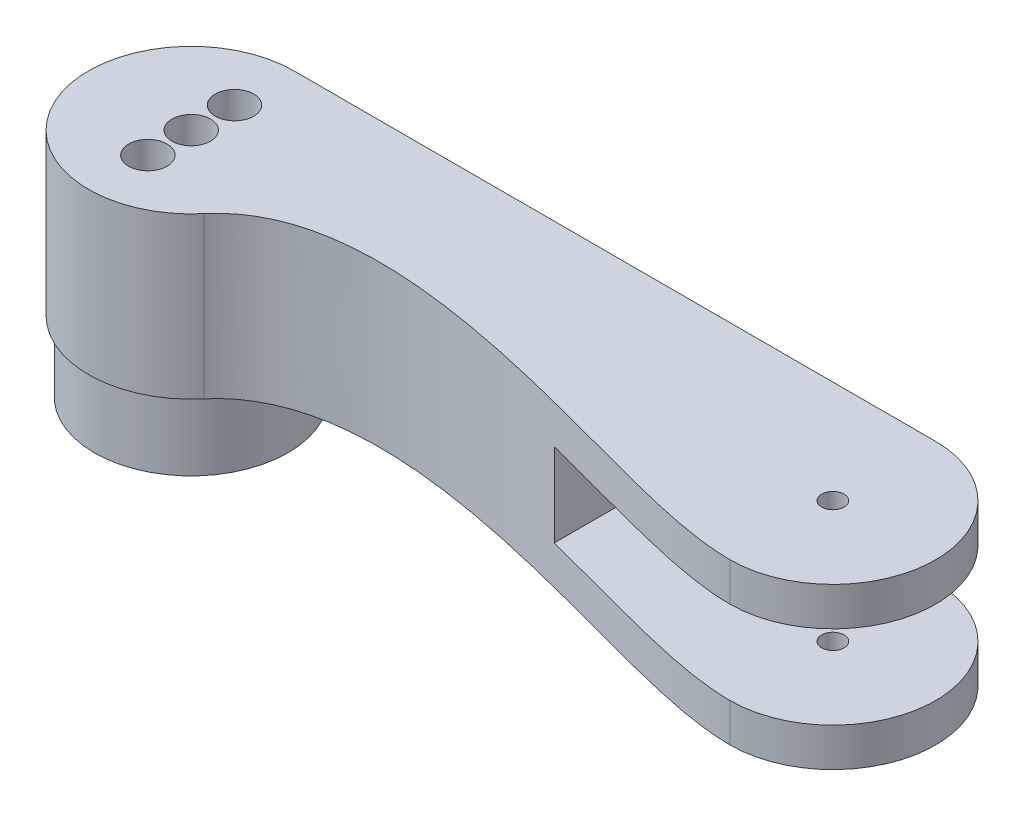
from build123d import *

# Parameters (mm, degrees)
BOSS_EXTRUDE1_DEPTH            = 6
SKETCH3_R                      = 1.75
CUT_EXTRUDE2_DEPTH             = 69.176242196
BOSS_EXTRUDE2_DEPTH            = 13
BOSS_EXTRUDE3_DEPTH            = 6
CUT_EXTRUDE3_REACH             = 74.367
SKETCH6_R                      = 1.75
CUT_EXTRUDE4_REACH             = 74.367
SKETCH8_R                      = 15.1
BOSS_EXTRUDE4_DEPTH            = 11
SKETCH9_R                      = 1.75
CUT_EXTRUDE5_DEPTH             = 10
CUT_EXTRUDE6_REACH             = 78.864
SKETCH11_R                     = 3
CUT_EXTRUDE6_DIRECTION_2_DEPTH = 77.863515556
CUT_EXTRUDE7_REACH             = 74.719
SKETCH12_R                     = 3


with BuildPart() as part:
    # Sketch1 → Boss-Extrude1 (new body)
    with BuildSketch(Plane(origin=(0, 0, 0), x_dir=(1, 0, 0), z_dir=(0, 1, 0))):
        with BuildLine():
            Line((-50, 16), (50, 16))
            ThreePointArc((50, 16), (66, 0), (50, -16))
            Line((50, -16), (-50, -16))
            ThreePointArc((-50, -16), (-66, 0), (-50, 16))
        make_face()
    extrude(amount=BOSS_EXTRUDE1_DEPTH)

    # Sketch3 → Cut-Extrude2 (cut, through all)
    with BuildSketch(Plane.XZ):
        with Locations(Location((50, 0, 0), (0, 0, 270))):
            Circle(SKETCH3_R)
    extrude(amount=-CUT_EXTRUDE2_DEPTH, mode=Mode.SUBTRACT)

    # Sketch4 → Boss-Extrude2 (add)
    with BuildSketch(Plane(origin=(0, 6, 0), x_dir=(1, 0, 0), z_dir=(0, 1, 0))):
        with BuildLine():
            Line((-50, 16), (15, 16))
            Line((15, 16), (15, -16))
            Line((15, -16), (-50, -16))
            ThreePointArc((-50, -16), (-66, 0), (-50, 16))
        make_face()
    extrude(amount=BOSS_EXTRUDE2_DEPTH)

    # Sketch5 → Boss-Extrude3 (add)
    with BuildSketch(Plane(origin=(0, 19, 0), x_dir=(1, 0, 0), z_dir=(0, 1, 0))):
        with BuildLine():
            Line((-50, 16), (50, 16))
            ThreePointArc((50, 16), (66, 0), (50, -16))
            Line((50, -16), (-50, -16))
            ThreePointArc((-50, -16), (-66, 0), (-50, 16))
        make_face()
    extrude(amount=BOSS_EXTRUDE3_DEPTH)

    # Sketch6 → Cut-Extrude3 (cut, up to next)
    with BuildSketch(Plane(origin=(0, 25, 0), x_dir=(1, 0, 0), z_dir=(0, 1, 0)), mode=Mode.PRIVATE) as cut_extrude3_sk1:
        with Locations(Location((50, 0, 0), (0, 0, 90))):
            Circle(SKETCH6_R)
    cut_extrude3_tool1 = extrude(cut_extrude3_sk1.sketch, amount=-CUT_EXTRUDE3_REACH, mode=Mode.PRIVATE) & part.part
    add(cut_extrude3_tool1.solids().sort_by_distance((50, 25, 0))[0], mode=Mode.SUBTRACT)

    # Sketch7 → Cut-Extrude4 (cut, up to next)
    with BuildSketch(Plane(origin=(0, 25, 0), x_dir=(1, 0, 0), z_dir=(0, 1, 0)), mode=Mode.PRIVATE) as cut_extrude4_sk1:
        with BuildLine():
            ThreePointArc((-37.731263809, -10.270253759), (-43.22962557, -14.496966237), (-50, -16))
            Line((-50, -16), (50, -16))
            add(Edge.make_bspline(
                [(-37.731263809, -10.270253759), (-30.332556703, -1.431836739), (6.050402888, -3.364587973), (38.512231583, -16), (50, -16)],
                knots=[0, 0, 0, 0, 0.426660683, 1, 1, 1, 1], degree=3))
        make_face()
    cut_extrude4_tool1 = extrude(cut_extrude4_sk1.sketch, amount=-CUT_EXTRUDE4_REACH, mode=Mode.PRIVATE) & part.part
    add(cut_extrude4_tool1.solids().sort_by_distance((-6.915299, 25, 11.013102))[0], mode=Mode.SUBTRACT)

    # Sketch8 → Boss-Extrude4 (add)
    with BuildSketch(Plane.XZ):
        with Locations(Location((-50, 0, 0), (0, 0, 90))):
            Circle(SKETCH8_R)
    extrude(amount=BOSS_EXTRUDE4_DEPTH)

    # Sketch9 → Cut-Extrude5 (cut)
    with BuildSketch(Plane.XZ.offset(11)):
        with Locations(Location((-50, 6.75, 0), (0, 0, 270))):
            Circle(SKETCH9_R)
        with Locations(Location((-50, -6.75, 0), (0, 0, 270))):
            Circle(SKETCH9_R)
    extrude(amount=-CUT_EXTRUDE5_DEPTH, mode=Mode.SUBTRACT)

    # Sketch11 → Cut-Extrude6 (cut, up to next)
    with BuildSketch(Plane.XZ.offset(11), mode=Mode.PRIVATE) as cut_extrude6_sk1:
        with Locations(Location((-50, 0, 0), (0, 0, 90))):
            Circle(SKETCH11_R)
    cut_extrude6_tool1 = extrude(cut_extrude6_sk1.sketch, amount=-CUT_EXTRUDE6_REACH, mode=Mode.PRIVATE) & part.part
    add(cut_extrude6_tool1.solids().sort_by_distance((-50, -11, 0))[0], mode=Mode.SUBTRACT)

    # Sketch11 → Cut-Extrude6 direction 2 (cut)
    with BuildSketch(Plane.XZ.offset(11)):
        with Locations(Location((-50, 0, 0), (0, 0, 90))):
            Circle(SKETCH11_R)
    extrude(amount=CUT_EXTRUDE6_DIRECTION_2_DEPTH, mode=Mode.SUBTRACT)

    # Sketch12 → Cut-Extrude7 (cut, up to next)
    with BuildSketch(Plane.XZ.offset(1), mode=Mode.PRIVATE) as cut_extrude7_sk1:
        with Locations(Location((-50, 6.75, 0), (0, 0, 270))):
            Circle(SKETCH12_R)
    cut_extrude7_tool1 = extrude(cut_extrude7_sk1.sketch, amount=-CUT_EXTRUDE7_REACH, mode=Mode.PRIVATE) & part.part
    # Sketch12 → Cut-Extrude7 (cut, up to next)
    with BuildSketch(Plane.XZ.offset(1), mode=Mode.PRIVATE) as cut_extrude7_sk2:
        with Locations(Location((-50, -6.75, 0), (0, 0, 270))):
            Circle(SKETCH12_R)
    cut_extrude7_tool2 = extrude(cut_extrude7_sk2.sketch, amount=-CUT_EXTRUDE7_REACH, mode=Mode.PRIVATE) & part.part
    add(cut_extrude7_tool1.solids().sort_by_distance((-50, -1, 6.75))[0], mode=Mode.SUBTRACT)
    add(cut_extrude7_tool2.solids().sort_by_distance((-50, -1, -6.75))[0], mode=Mode.SUBTRACT)


solid = part.part
